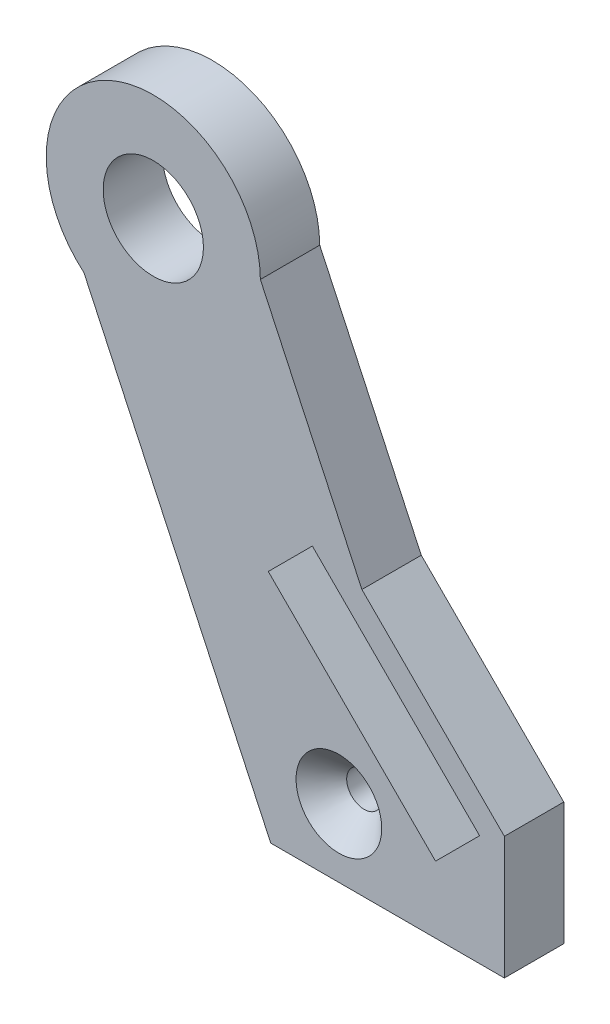
from build123d import *

# Parameters (mm, degrees)
SKETCH1_R                                       = 0.9
SKETCH1_R_2                                     = 2.575
BOSS_EXTRUDE1_DEPTH                             = 3.05
CSK_FOR_M2_FLAT_HEAD_MACHINE_SCREW1_D           = 1.8
CSK_FOR_M2_FLAT_HEAD_MACHINE_SCREW1_CSINK_D     = 4.4
CSK_FOR_M2_FLAT_HEAD_MACHINE_SCREW1_CSINK_ANGLE = 90


with BuildPart() as part:
    # Sketch1 → Boss-Extrude1 (new body)
    with BuildSketch(Plane.XY):
        with BuildLine():
            Line((12, 0), (12, 6.303908615))
            Line((12, 6.303908615), (4.681585686, 13.62232293))
            Line((4.681585686, 13.62232293), (-0.534038586, 24.807265275))
            ThreePointArc((-0.534038586, 24.807265275), (-8.358318048, 29.755478813), (-9.597116456, 20.581082657))
            Line((-9.597116456, 20.581082657), (0, 0))
            Line((0, 0), (12, 0))
        make_face()
        Polygon((10.727207794, 5.692209589), (8.464466094, 3.429467889), (-0.126881297, 12.02081528), (2.135860402, 14.28355698), align=None, mode=Mode.SUBTRACT)
        with Locations((3.5, 3.5)):
            Circle(SKETCH1_R, mode=Mode.SUBTRACT)
        with Locations((-6.033917608, 24.770785985)):
            Circle(SKETCH1_R_2, mode=Mode.SUBTRACT)
    extrude(amount=BOSS_EXTRUDE1_DEPTH)

    # CSK for M2 Flat Head Machine Screw1 (through all)
    with Locations(Plane.XY.offset(3.05)):
        with Locations((3.5, 3.5)):
            CounterSinkHole(CSK_FOR_M2_FLAT_HEAD_MACHINE_SCREW1_D / 2, CSK_FOR_M2_FLAT_HEAD_MACHINE_SCREW1_CSINK_D / 2, counter_sink_angle=CSK_FOR_M2_FLAT_HEAD_MACHINE_SCREW1_CSINK_ANGLE)


solid = part.part
